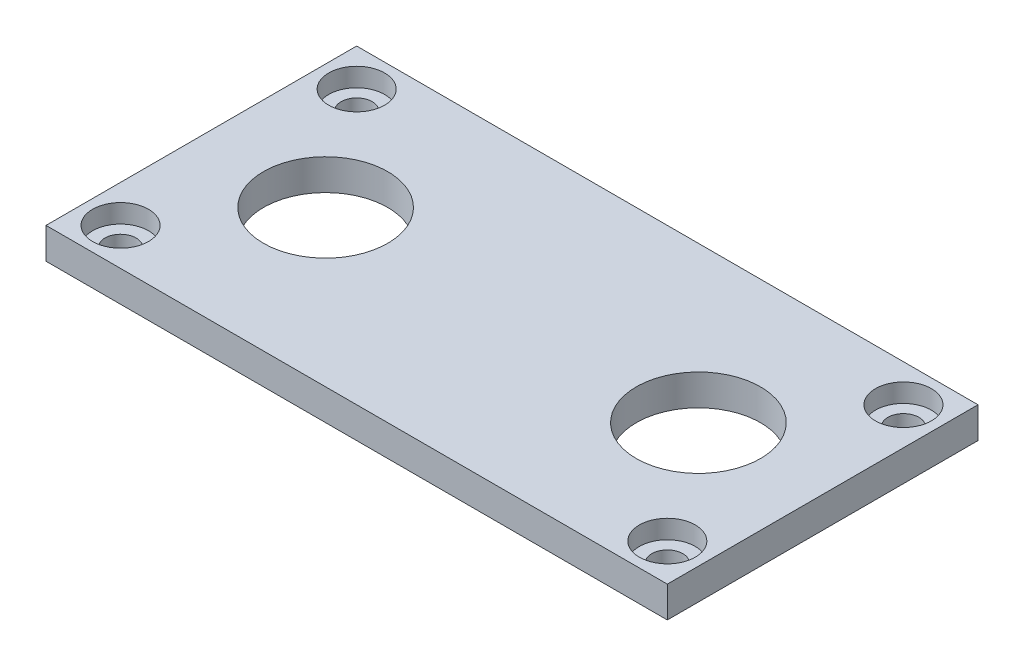
from build123d import *

# Parameters (mm, degrees)
SKETCH1_W           = 100
SKETCH1_H           = 50
SKETCH1_R           = 10
SKETCH1_R_2         = 2.5
BOSS_EXTRUDE1_DEPTH = 5
SKETCH2_R           = 4.5
CUT_EXTRUDE1_DEPTH  = 3


with BuildPart() as part:
    # Sketch1 → Boss-Extrude1 (new body)
    with BuildSketch(Plane(origin=(0, 0, 0), x_dir=(1, 0, 0), z_dir=(0, 1, 0))):
        Rectangle(SKETCH1_W, SKETCH1_H)
        with Locations(Location((30, 0, 0), (0, 0, 270))):
            Circle(SKETCH1_R, mode=Mode.SUBTRACT)
        with Locations(Location((-30, 0, 0), (0, 0, 270))):
            Circle(SKETCH1_R, mode=Mode.SUBTRACT)
        with Locations(Location((44, 19, 0), (0, 0, 270))):
            Circle(SKETCH1_R_2, mode=Mode.SUBTRACT)
        with Locations(Location((-44, 19, 0), (0, 0, 270))):
            Circle(SKETCH1_R_2, mode=Mode.SUBTRACT)
        with Locations(Location((-44, -19, 0), (0, 0, 270))):
            Circle(SKETCH1_R_2, mode=Mode.SUBTRACT)
        with Locations(Location((44, -19, 0), (0, 0, 270))):
            Circle(SKETCH1_R_2, mode=Mode.SUBTRACT)
    extrude(amount=BOSS_EXTRUDE1_DEPTH)

    # Sketch2 → Cut-Extrude1 (cut)
    with BuildSketch(Plane(origin=(0, 5, 0), x_dir=(1, 0, 0), z_dir=(0, 1, 0))):
        with Locations(Location((-44, 19, 0), (0, 0, 270))):
            Circle(SKETCH2_R)
        with Locations(Location((-44, -19, 0), (0, 0, 270))):
            Circle(SKETCH2_R)
        with Locations(Location((44, -19, 0), (0, 0, 270))):
            Circle(SKETCH2_R)
        with Locations(Location((44, 19, 0), (0, 0, 270))):
            Circle(SKETCH2_R)
    extrude(amount=-CUT_EXTRUDE1_DEPTH, mode=Mode.SUBTRACT)


solid = part.part
